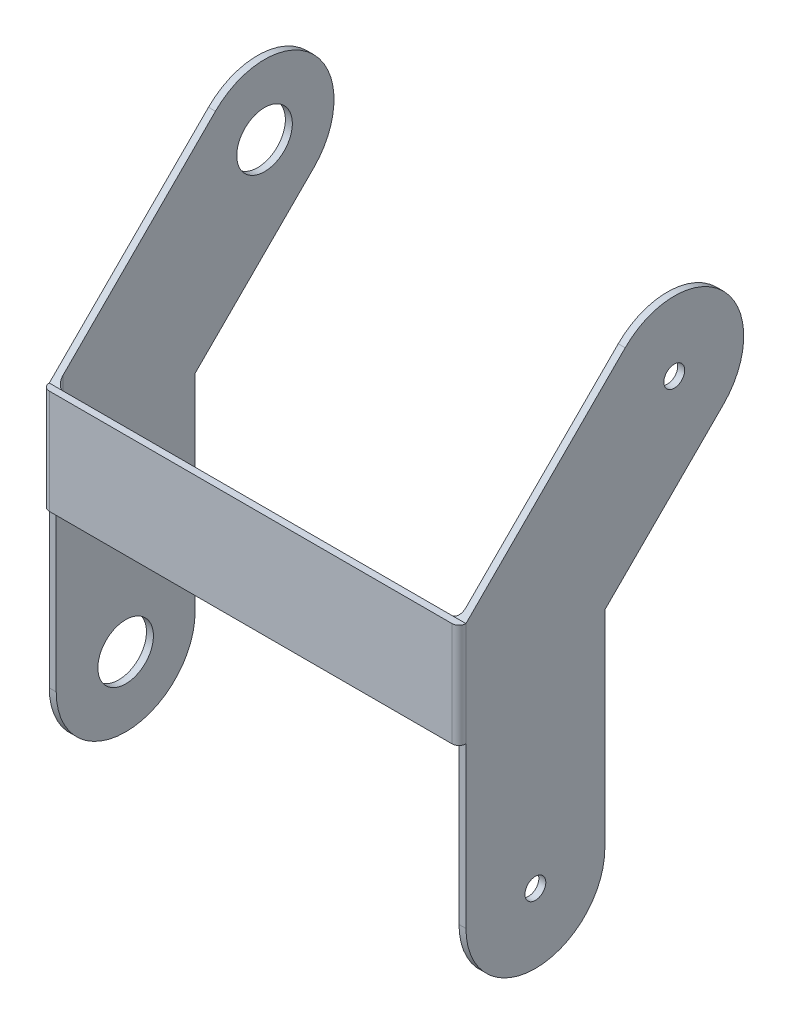
from build123d import *

# Parameters (mm, degrees)
SKETCH1_R           = 1.5
BOSS_EXTRUDE1_DEPTH = 1
BOSS_EXTRUDE2_START = -1
SKETCH2_W           = 1
SKETCH2_H           = 15
BOSS_EXTRUDE2_DEPTH = 30
FILLET1_R           = 1
CUT_EXTRUDE1_REACH  = 88.636
SKETCH3_R           = 4


with BuildPart() as part:
    # Sketch1 → Boss-Extrude1 (new body)
    with BuildSketch(Plane(origin=(0, 0, 0), x_dir=(0, 0, -1), z_dir=(1, 0, 0))):
        with BuildLine():
            Line((0, 0), (22.928644487, 22.928644487))
            ThreePointArc((22.928644487, 22.928644487), (37.07078011, 22.928644487), (37.07078011, 8.786508863))
            Line((37.07078011, 8.786508863), (20, -8.284271247))
            Line((20, -8.284271247), (20, -38.019))
            ThreePointArc((20, -38.019), (10, -48.019), (0, -38.019))
            Line((0, -38.019), (0, 0))
        make_face()
        with Locations((29.999712299, 15.857576675)):
            Circle(SKETCH1_R, mode=Mode.SUBTRACT)
        with Locations((10, -38.019)):
            Circle(SKETCH1_R, mode=Mode.SUBTRACT)
    boss_extrude1 = extrude(amount=BOSS_EXTRUDE1_DEPTH)

    # Sketch2 → Boss-Extrude2 (add)
    with BuildSketch(Plane(origin=(1, 0, 0), x_dir=(0, 0, -1), z_dir=(1, 0, 0)).offset(BOSS_EXTRUDE2_START)):
        with Locations((-0.5, -7.5)):
            Rectangle(SKETCH2_W, SKETCH2_H)
    boss_extrude2 = extrude(amount=BOSS_EXTRUDE2_DEPTH)

    # Mirror2: Boss-Extrude1, Boss-Extrude2 across plane
    add(boss_extrude1.mirror(Plane.ZY.offset(-30)))
    add(boss_extrude2.mirror(Plane.ZY.offset(-30)))

    # Fillet1
    fillet1_edges = [part.edges().sort_by_distance(p)[0] for p in [
        (1, -7.5, 0),
        (59, -7.5, 0),
        (0, -7.5, 1),
        (60, -7.5, 1),
    ]]
    fillet(fillet1_edges, radius=FILLET1_R)

    # Sketch3 → Cut-Extrude1 (cut, up to next)
    with BuildSketch(Plane.ZY, mode=Mode.PRIVATE) as cut_extrude1_sk1:
        with Locations((-29.999712299, 15.857576675)):
            Circle(SKETCH3_R)
    cut_extrude1_tool1 = extrude(cut_extrude1_sk1.sketch, amount=-CUT_EXTRUDE1_REACH, mode=Mode.PRIVATE) & part.part
    # Sketch3 → Cut-Extrude1 (cut, up to next)
    with BuildSketch(Plane.ZY, mode=Mode.PRIVATE) as cut_extrude1_sk2:
        with Locations((-10, -38.019)):
            Circle(SKETCH3_R)
    cut_extrude1_tool2 = extrude(cut_extrude1_sk2.sketch, amount=-CUT_EXTRUDE1_REACH, mode=Mode.PRIVATE) & part.part
    add(cut_extrude1_tool1.solids().sort_by_distance((0, 15.857577, -29.999712))[0], mode=Mode.SUBTRACT)
    add(cut_extrude1_tool2.solids().sort_by_distance((0, -38.019, -10))[0], mode=Mode.SUBTRACT)


solid = part.part
